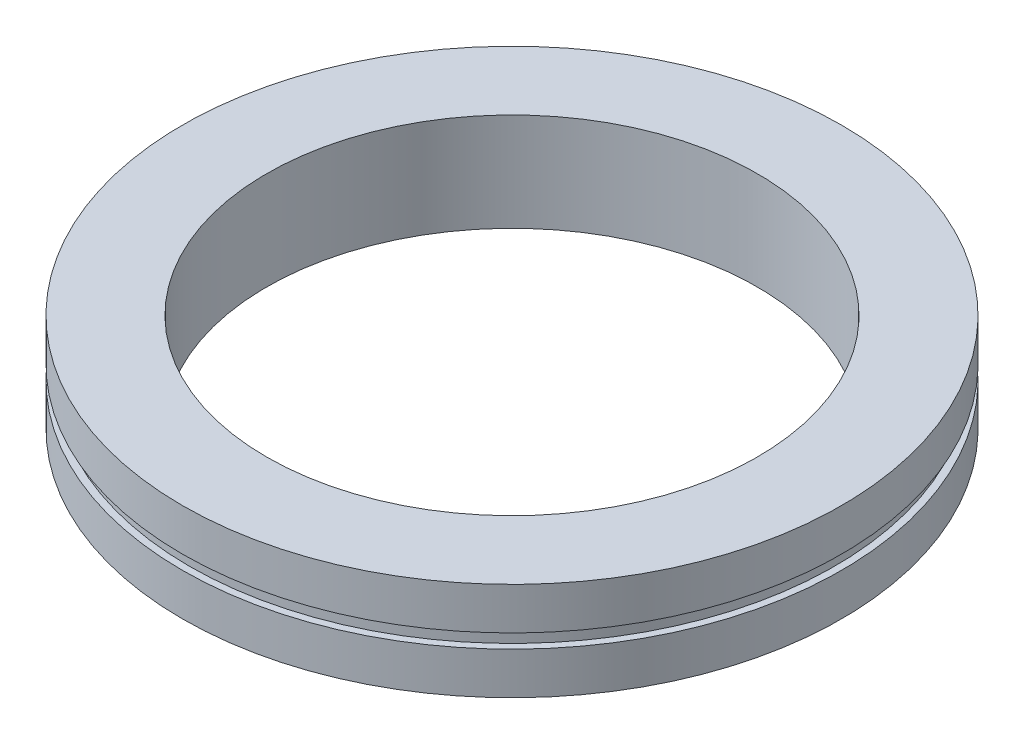
from build123d import *

# Parameters (mm, degrees)
SKETCH_1_R      = 23.5
SKETCH_1_R_2    = 17.5
EXTRUDE_1_DEPTH = 7
SKETCH_2_W      = 0.5
SKETCH_2_H      = 1


with BuildPart() as part:
    # 草图1 → 凸台-拉伸1 (new body)
    with BuildSketch(Plane(origin=(0, 0, 0), x_dir=(1, 0, 0), z_dir=(0, 1, 0))):
        with Locations(Location((0, 0, 0), (0, 0, 270))):
            Circle(SKETCH_1_R)
        with Locations(Location((0, 0, 0), (0, 0, 270))):
            Circle(SKETCH_1_R_2, mode=Mode.SUBTRACT)
    extrude(amount=EXTRUDE_1_DEPTH)

    # 草图2 → 切除-旋转1 (revolve, cut)
    with BuildSketch(Plane.XY, mode=Mode.PRIVATE) as cut_revolve_1_sk:
        with Locations((23.25, 3.5)):
            Rectangle(SKETCH_2_W, SKETCH_2_H)
    revolve(cut_revolve_1_sk.sketch.rotate(Axis((0, 7, 0), (0, -1, 0)), 90), axis=Axis((0, 7, 0), (0, -1, 0)), mode=Mode.SUBTRACT)


solid = part.part
